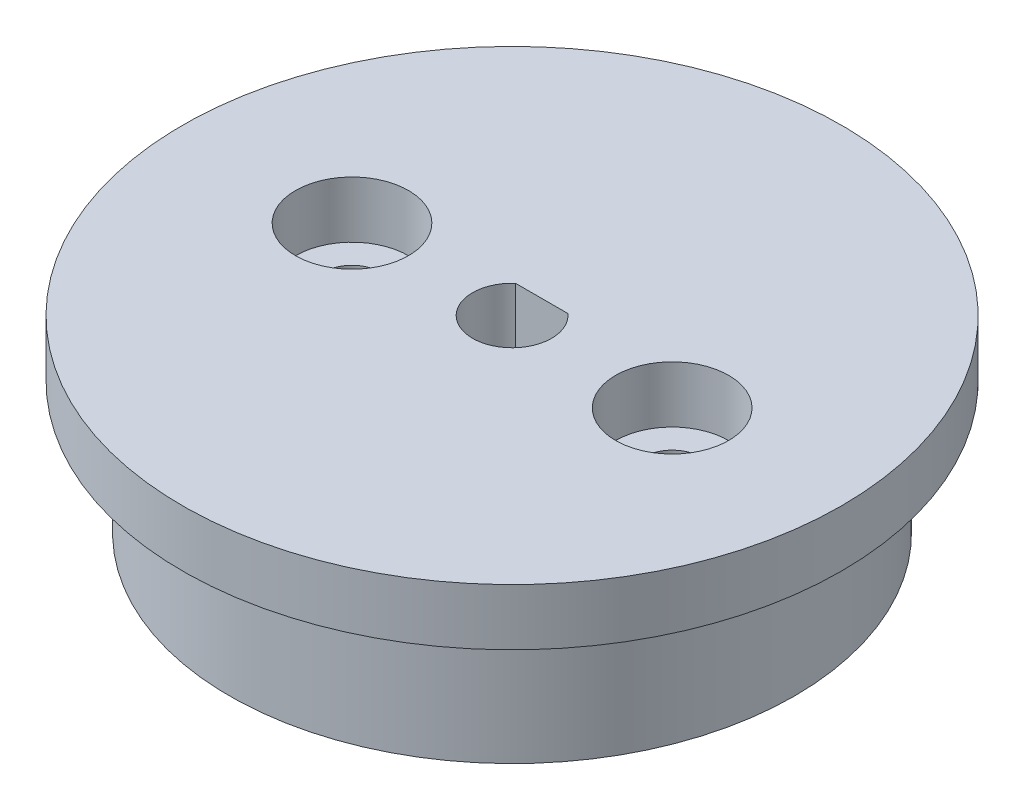
from build123d import *

# Parameters (mm, degrees)
ESBO_O2_R             = 1.5
CORTE_EXTRUS_O1_DEPTH = 10
ESBO_O3_R             = 3
CORTE_EXTRUS_O2_DEPTH = 3


with BuildPart() as part:
    # Esboço1 → Revolução2 (revolve)
    with BuildSketch(Plane.XY, mode=Mode.PRIVATE) as revolu_o2_sk:
        Polygon((0, 7), (-2.5, 7), (-2.5, 10), (15, 10), (15, 0), (0, 0), align=None)
    revolve(revolu_o2_sk.sketch.rotate(Axis((15, 0, 0), (0, 1, 0)), 180), axis=Axis((15, 0, 0), (0, 1, 0)))

    # Esboço2 → Corte-extrusão1 (cut)
    with BuildSketch(Plane(origin=(0, 0, 0), x_dir=(-1, 0, 0), z_dir=(0, -1, 0))):
        with Locations(Location((-23.5, 0, 0), (0, 0, 180))):
            Circle(ESBO_O2_R)
        with Locations(Location((-6.5, 0, 0), (0, 0, 180))):
            Circle(ESBO_O2_R)
        with BuildLine():
            Line((-16.39, 1.574134683), (-13.61, 1.574134683))
            ThreePointArc((-13.61, 1.574134683), (-15, -2.1), (-16.39, 1.574134683))
        make_face()
    extrude(amount=-CORTE_EXTRUS_O1_DEPTH, mode=Mode.SUBTRACT)

    # Esboço3 → Corte-extrusão2 (cut)
    with BuildSketch(Plane(origin=(0, 10, 0), x_dir=(1, 0, 0), z_dir=(0, 1, 0))):
        with Locations(Location((6.5, 0, 0), (0, 0, 180))):
            Circle(ESBO_O3_R)
        with Locations(Location((23.5, 0, 0), (0, 0, 180))):
            Circle(ESBO_O3_R)
    extrude(amount=-CORTE_EXTRUS_O2_DEPTH, mode=Mode.SUBTRACT)


solid = part.part
